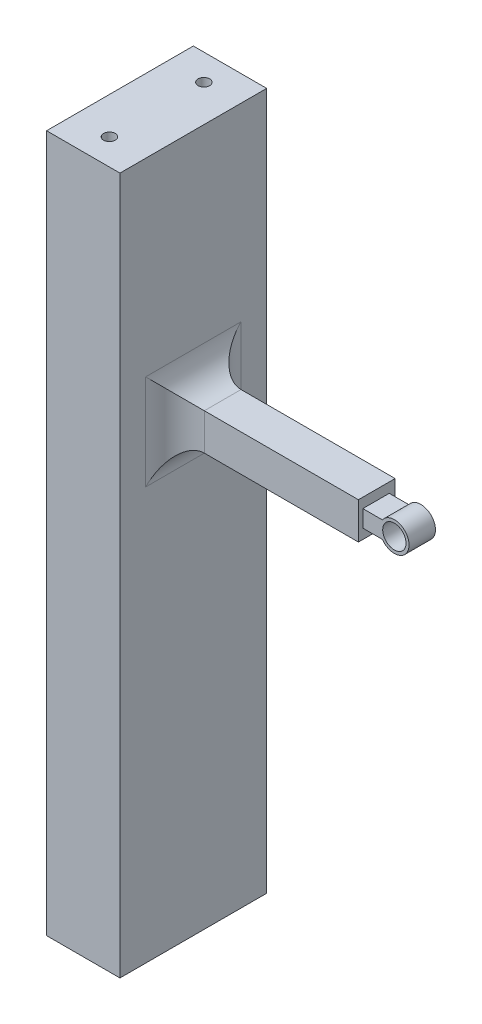
from build123d import *

# Parameters (mm, degrees)
SKETCH1_W           = 100
SKETCH1_H           = 1100
BOSS_EXTRUDE1_DEPTH = 200
SKETCH3_W           = 50
SKETCH3_H           = 50
BOSS_EXTRUDE2_DEPTH = 250
FILLET1_R           = 40
BOSS_EXTRUDE3_START = -6
SKETCH4_R           = 15.875
BOSS_EXTRUDE3_DEPTH = 36
SKETCH5_R           = 26
CUT_EXTRUDE1_DEPTH  = 20
SKETCH6_W           = 100
SKETCH6_H           = 200
CUT_EXTRUDE2_DEPTH  = 150
SKETCH7_R           = 26
CUT_EXTRUDE3_DEPTH  = 40
CUT_EXTRUDE5_DEPTH  = 40
CUT_EXTRUDE6_DEPTH  = 40


with BuildPart() as part:
    # Sketch1 → Boss-Extrude1 (new body)
    with BuildSketch(Plane.XY):
        with Locations((-162.86470473, 483.969884115)):
            Rectangle(SKETCH1_W, SKETCH1_H)
    extrude(amount=BOSS_EXTRUDE1_DEPTH)

    # Sketch3 → Boss-Extrude2 (add)
    with BuildSketch(Plane(origin=(-112.86470473, 0, 0), x_dir=(0, 0, -1), z_dir=(1, 0, 0))):
        with Locations((-100, 710.969884115)):
            Rectangle(SKETCH3_W, SKETCH3_H)
    extrude(amount=BOSS_EXTRUDE2_DEPTH)

    # Fillet1
    fillet1_edges = [part.edges().sort_by_distance(p)[0] for p in [
        (-112.86470473, 735.969884115, 100),
        (-112.86470473, 685.969884115, 100),
        (-112.86470473, 710.969884115, 75),
        (-112.86470473, 710.969884115, 125),
    ]]
    fillet(fillet1_edges, radius=FILLET1_R)

    # Sketch4 → Boss-Extrude3 (add)
    with BuildSketch(Plane.XY.offset(125).offset(BOSS_EXTRUDE3_START)):
        with BuildLine():
            Line((137.13529527, 722.492751407), (137.13529527, 699.447016824))
            Line((137.13529527, 699.447016824), (163.788322175, 699.447016824))
            ThreePointArc((163.788322175, 699.447016824), (200.13529527, 710.969884115), (163.788322175, 722.492751407))
            Line((163.788322175, 722.492751407), (137.13529527, 722.492751407))
        make_face()
        with Locations((180.13529527, 710.969884115)):
            Circle(SKETCH4_R, mode=Mode.SUBTRACT)
    extrude(amount=-BOSS_EXTRUDE3_DEPTH)

    # Sketch5 → Cut-Extrude1 (cut)
    with BuildSketch(Plane.XZ.offset(66.030115885)):
        with Locations((-162.86470473, 100)):
            Circle(SKETCH5_R)
    extrude(amount=-CUT_EXTRUDE1_DEPTH, mode=Mode.SUBTRACT)

    # Sketch6 → Cut-Extrude2 (cut)
    with BuildSketch(Plane.XZ.offset(66.030115885)):
        with Locations((-162.86470473, 100)):
            Rectangle(SKETCH6_W, SKETCH6_H)
    extrude(amount=-CUT_EXTRUDE2_DEPTH, mode=Mode.SUBTRACT)

    # Sketch7 → Cut-Extrude3 (cut)
    with BuildSketch(Plane.XZ.offset(-83.969884115)):
        with Locations((-162.86470473, 100)):
            Circle(SKETCH7_R)
    extrude(amount=-CUT_EXTRUDE3_DEPTH, mode=Mode.SUBTRACT)

    # Sketch9 → Cut-Extrude5 (cut)
    with BuildSketch(Plane(origin=(0, 1033.969884115, 0), x_dir=(1, 0, 0), z_dir=(0, 1, 0))):
        with BuildLine():
            ThreePointArc((-154.86470473, -164.3765), (-157.20785048, -158.719645751), (-162.86470473, -156.3765))
            ThreePointArc((-162.86470473, -156.3765), (-168.521558979, -170.033354249), (-154.86470473, -164.3765))
        make_face()
    extrude(amount=-CUT_EXTRUDE5_DEPTH, mode=Mode.SUBTRACT)

    # Sketch9<4> → Cut-Extrude6 (cut)
    with BuildSketch(Plane(origin=(0, 1033.969884115, 0), x_dir=(1, 0, 0), z_dir=(0, 1, 0))):
        with BuildLine():
            ThreePointArc((-154.86470473, -35.6235), (-168.521558979, -29.966645751), (-162.86470473, -43.6235))
            ThreePointArc((-162.86470473, -43.6235), (-157.20785048, -41.280354249), (-154.86470473, -35.6235))
        make_face()
    extrude(amount=-CUT_EXTRUDE6_DEPTH, mode=Mode.SUBTRACT)


solid = part.part
